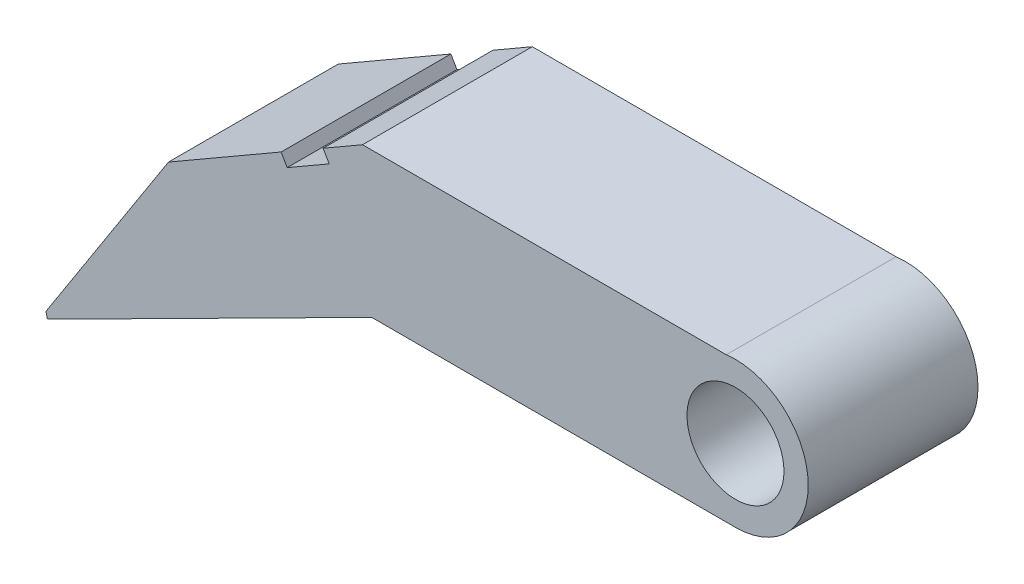
from build123d import *

# Parameters (mm, degrees)
SKETCH_1_R          = 3
SKETCH_1_R_2        = 2
EXTRUDE_1_DEPTH     = 7
SKETCH_2_R          = 2
EXTRUDE_2_DEPTH     = 7
CHAMFER_1_SIZE      = 0.5
CHAMFER_1_SIZE2     = 0.365244226
SKETCH_3_W          = 2
SKETCH_3_H          = 0.5
CUT_EXTRUDE_1_DEPTH = 7
SKETCH_4_W          = 2
SKETCH_4_H          = 7
EXTRUDE_3_DEPTH     = 0.5


with BuildPart() as part:
    # 草图1 → 凸台-拉伸1 (new body)
    with BuildSketch(Plane.XY):
        Circle(SKETCH_1_R)
        Circle(SKETCH_1_R_2, mode=Mode.SUBTRACT)
    extrude(amount=EXTRUDE_1_DEPTH)

    # 草图2 → 凸台-拉伸2 (add)
    with BuildSketch(Plane(origin=(0, 0, 0), x_dir=(-1, 0, 0), z_dir=(0, 0, -1))):
        with BuildLine():
            Line((0.378213472, 2.976063603), (15.378213472, 2.976063603))
            Line((15.378213472, 2.976063603), (23.378213472, -1.64273855))
            Line((23.378213472, -1.64273855), (28.699571557, -9.91799539))
            Line((28.699571557, -9.91799539), (15, -3))
            Line((15, -3), (0, -3))
            ThreePointArc((0, -3), (-2.994009921, 0.189485079), (0.378213472, 2.976063603))
        make_face()
        with Locations(Location((0, 0, 0), (0, 0, 180))):
            Circle(SKETCH_2_R, mode=Mode.SUBTRACT)
    extrude(amount=-EXTRUDE_2_DEPTH)

    # 倒角1
    chamfer_1_edges = [part.edges().sort_by_distance(p)[0] for p in [
        (-28.699571557, -9.91799539, 3.5),
    ]]
    chamfer_1_side = [part.faces().sort_by_distance(p)[0] for p in [
        (-26.038892515, -5.78036697, 3.5),
    ]]
    chamfer(chamfer_1_edges, length=CHAMFER_1_SIZE, length2=CHAMFER_1_SIZE2, reference=chamfer_1_side[0])

    # 草图3 → 切除-拉伸1 (cut)
    with BuildSketch(Plane(origin=(0, 0, 0), x_dir=(-1, 0, 0), z_dir=(0, 0, -1))):
        with Locations((11, 2.726063603)):
            Rectangle(SKETCH_3_W, SKETCH_3_H)
        Polygon((17.002138833, 2.038489859), (16.752138833, 1.605477157), (18.484189641, 0.605477157), (18.734189641, 1.038489859), align=None)
    extrude(amount=-CUT_EXTRUDE_1_DEPTH, mode=Mode.SUBTRACT)

    # 草图4 → 凸台-拉伸3 (add)
    with BuildSketch(Plane(origin=(0, 2.476063603, 0), x_dir=(1, 0, 0), z_dir=(0, 1, 0))):
        with Locations((-11, -3.5)):
            Rectangle(SKETCH_4_W, SKETCH_4_H)
    extrude(amount=EXTRUDE_3_DEPTH)


solid = part.part
